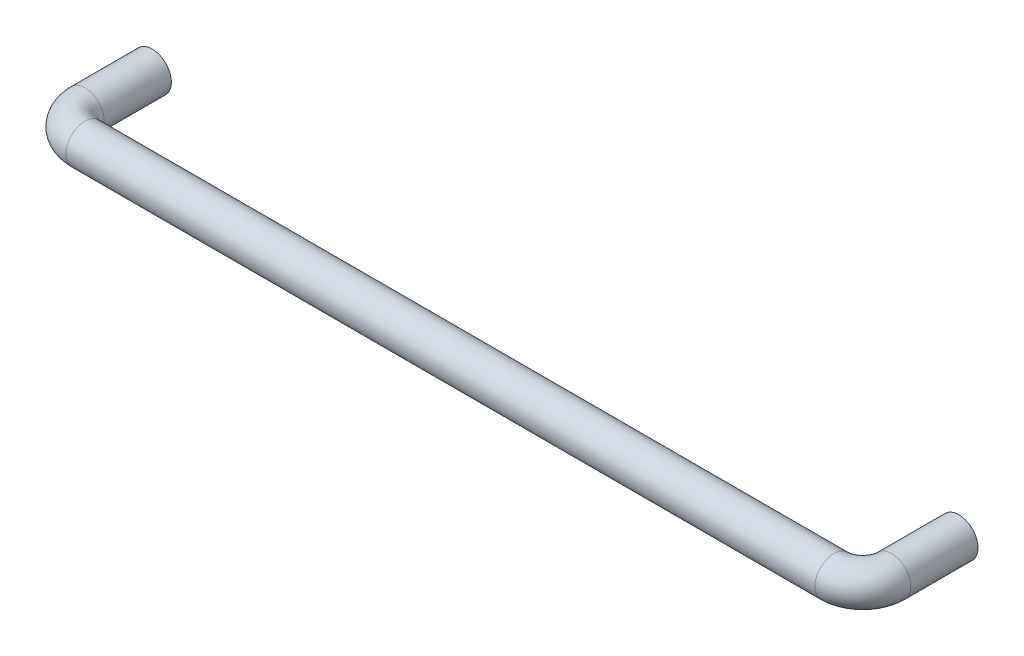
from build123d import *

# Parameters (mm, degrees)
SKETCH2_R = 1


with BuildPart() as part:
    # Sweep1: sweep along a path in Sketch1
    with BuildLine(Plane(origin=(0, 0, 0), x_dir=(1, 0, 0), z_dir=(0, 1, 0))) as sweep1_path:
        Line((0, 0), (0, -3.5))
        ThreePointArc((0, -3.5), (-0.439339828, -4.560660172), (-1.5, -5))
        Line((-1.5, -5), (-40.5, -5))
        ThreePointArc((-40.5, -5), (-41.560660172, -4.560660172), (-42, -3.5))
        Line((-42, -3.5), (-42, 0))
    # Sketch2 → Sweep1 (sweep)
    with BuildSketch(Plane.XY):
        Circle(SKETCH2_R)
    sweep(path=sweep1_path.line)


solid = part.part
